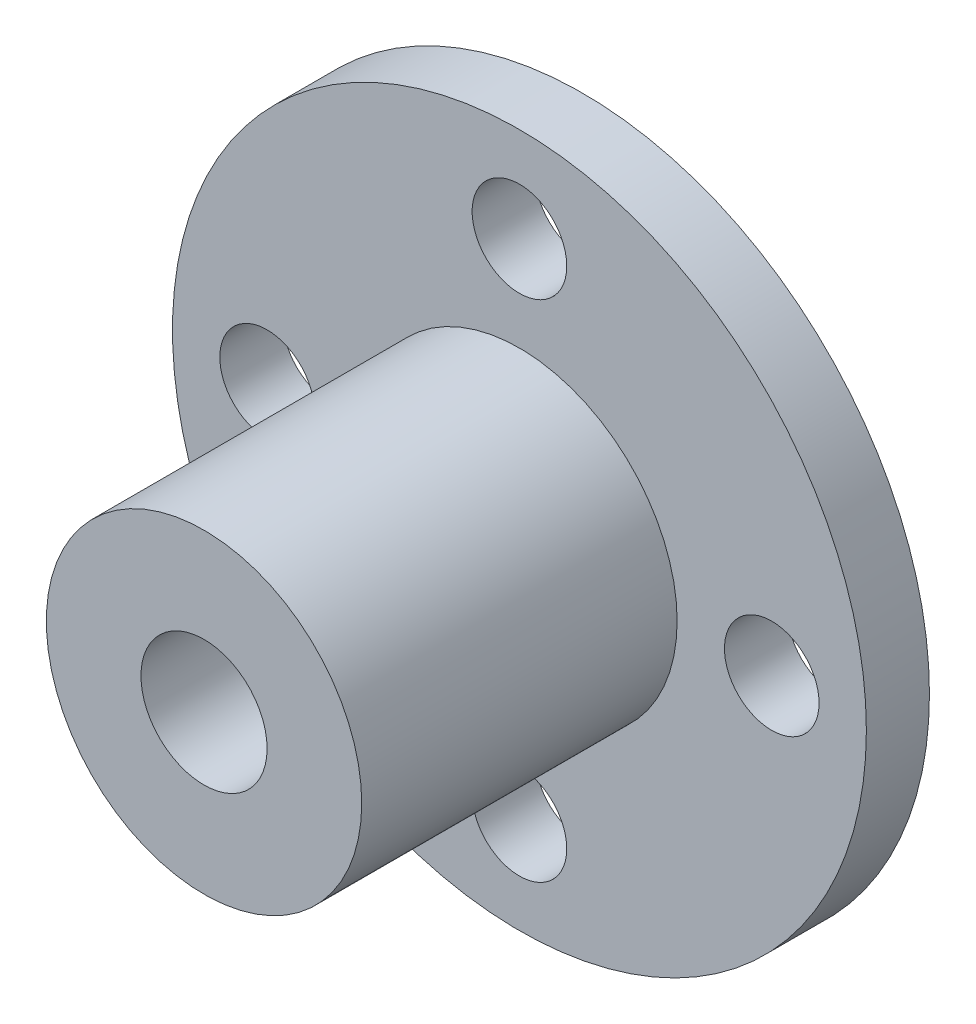
from build123d import *

# Parameters (mm, degrees)
SKETCH1_R           = 11
SKETCH1_R_2         = 1.5
SKETCH1_R_3         = 5
BOSS_EXTRUDE1_DEPTH = 2
SKETCH1_3_R         = 5
SKETCH1_3_R_2       = 2
BOSS_EXTRUDE2_DEPTH = 12


with BuildPart() as part:
    # Sketch1 → Boss-Extrude1 (new body)
    with BuildSketch(Plane.XY):
        Circle(SKETCH1_R)
        with Locations((0, -8)):
            Circle(SKETCH1_R_2, mode=Mode.SUBTRACT)
        with Locations((-8, 0)):
            Circle(SKETCH1_R_2, mode=Mode.SUBTRACT)
        Circle(SKETCH1_R_3, mode=Mode.SUBTRACT)
        with Locations((8, 0)):
            Circle(SKETCH1_R_2, mode=Mode.SUBTRACT)
        with Locations((0, 8)):
            Circle(SKETCH1_R_2, mode=Mode.SUBTRACT)
    extrude(amount=BOSS_EXTRUDE1_DEPTH)

    # Sketch1<3> → Boss-Extrude2 (add)
    with BuildSketch(Plane.XY):
        Circle(SKETCH1_3_R)
        Circle(SKETCH1_3_R_2, mode=Mode.SUBTRACT)
    extrude(amount=BOSS_EXTRUDE2_DEPTH)


solid = part.part
